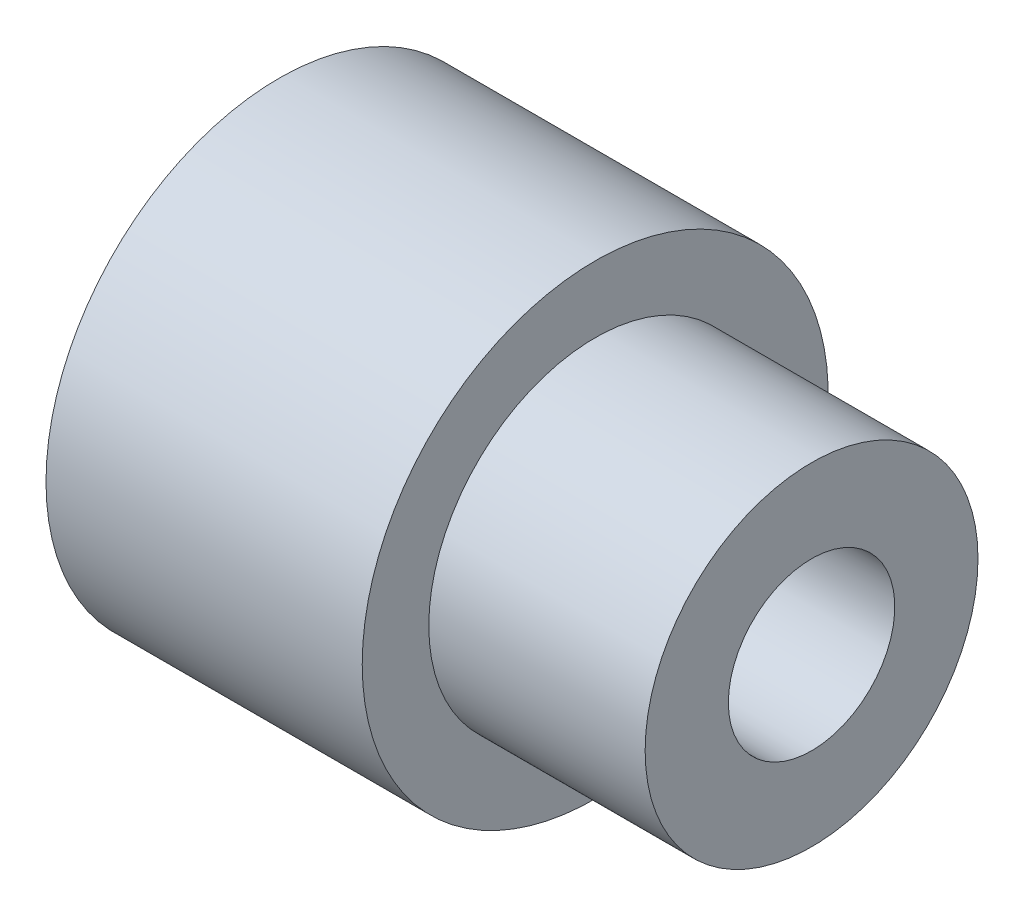
from build123d import *


with BuildPart() as part:
    # Sketch1 → Revolve1 (revolve)
    with BuildSketch(Plane.XY, mode=Mode.PRIVATE) as revolve1_sk:
        Polygon((-16, 11), (-16, 14), (3, 14), (3, 10), (16, 10), (16, 5), (0, 5), (0, 9), (-10, 9), (-10, 11), align=None)
    revolve(revolve1_sk.sketch.rotate(Axis((-24.612587064, 0, 0), (1, 0, 0)), 90), axis=Axis((-24.612587064, 0, 0), (1, 0, 0)))


solid = part.part
